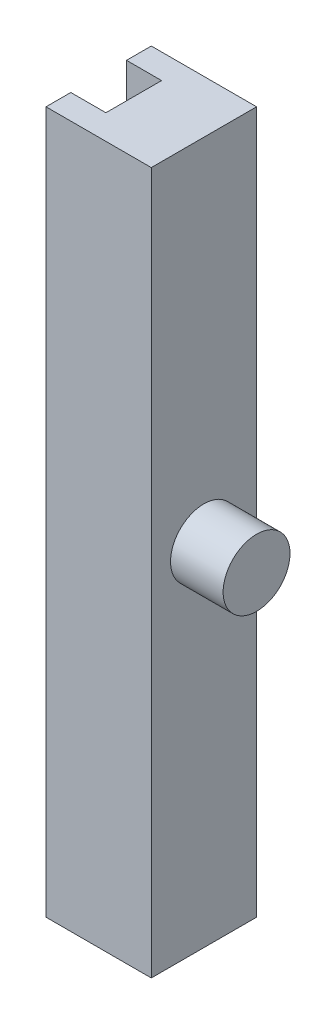
from build123d import *

# Parameters (mm, degrees)
BOSS_EXTRUDE1_DEPTH = 40
SKETCH3_R           = 1.905
BOSS_EXTRUDE2_DEPTH = 3


with BuildPart() as part:
    # Sketch2 → Boss-Extrude1 (new body)
    with BuildSketch(Plane(origin=(0, 0, 0), x_dir=(1, 0, 0), z_dir=(0, 1, 0))):
        Polygon((0, 0), (6, 0), (6, 6), (0, 6), (0, 4.5875), (2, 4.5875), (2, 1.4125), (0, 1.4125), align=None)
    extrude(amount=-BOSS_EXTRUDE1_DEPTH)

    # Sketch3 → Boss-Extrude2 (add)
    with BuildSketch(Plane(origin=(6, 0, 0), x_dir=(0, 0, -1), z_dir=(1, 0, 0))):
        with Locations((3, -20)):
            Circle(SKETCH3_R)
    extrude(amount=BOSS_EXTRUDE2_DEPTH)


solid = part.part
